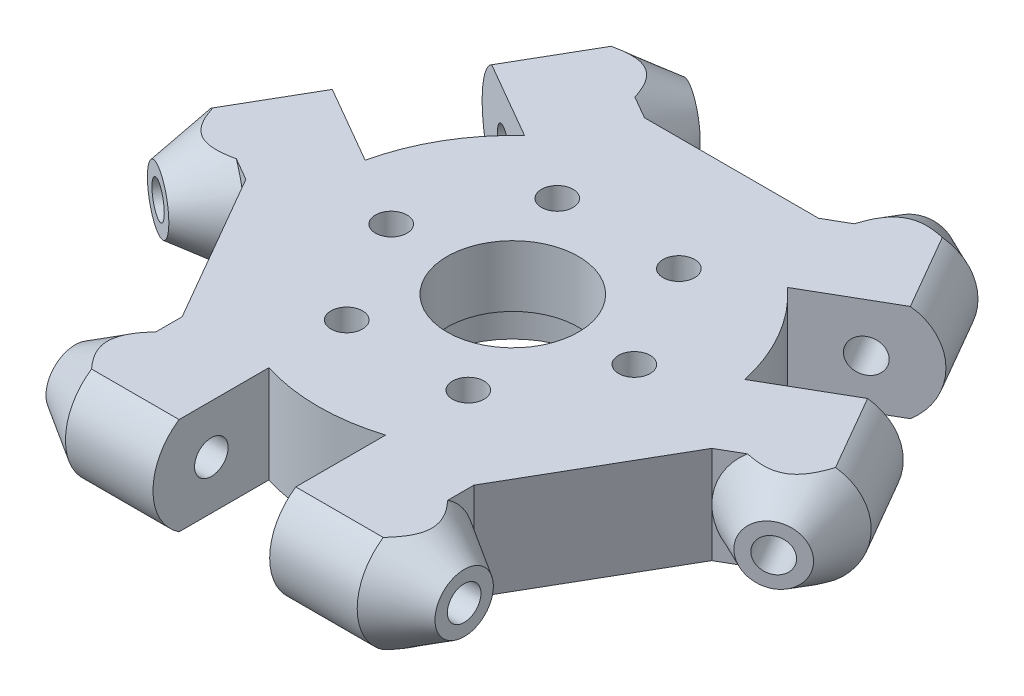
from build123d import *

# Parameters (mm, degrees)
BOSS_EXTRUDE1_DEPTH      = 5
BOSS_EXTRUDE1_DEPTH_BACK = 5
CIRPATTERN1_COUNT        = 3
SKETCH7_R                = 1.725
CUT_EXTRUDE2_DEPTH       = 47.868710659
CIRPATTERN2_COUNT        = 3
CUT_EXTRUDE3_DEPTH       = 47.751214304
CUT_EXTRUDE3_DEPTH_BACK  = 47.751214304
SKETCH8_R                = 8.5
SKETCH8_R_2              = 1.625
SKETCH9_R                = 8.5
SKETCH9_R_2              = 6.75
BOSS_EXTRUDE2_DEPTH      = 6.3


with BuildPart() as part:
    # Sketch4 → Boss-Extrude1 (new, two sides: drawn at the far end of the back side and taken through both)
    with BuildSketch(Plane(origin=(0, 0, 0), x_dir=(1, 0, 0), z_dir=(0, 1, 0)).offset(-BOSS_EXTRUDE1_DEPTH_BACK)):
        with BuildLine():
            Line((23.846787517, 20.696152423), (13.522711642, 14.735544437))
            ThreePointArc((13.522711642, 14.735544437), (17.320508076, 10), (19.522711642, 4.343239591))
            Line((19.522711642, 4.343239591), (29.846787517, 10.303847577))
            Line((29.846787517, 10.303847577), (34.346787517, 2.509618943))
            Line((34.346787517, 2.509618943), (23.954482672, -3.490381057))
            Line((23.954482672, -3.490381057), (15, -19))
            Line((15, -19), (15, -31))
            Line((15, -31), (6, -31))
            Line((6, -31), (6, -19.078784028))
            ThreePointArc((6, -19.078784028), (0, -20), (-6, -19.078784028))
            Line((-6, -19.078784028), (-6, -31))
            Line((-6, -31), (-15, -31))
            Line((-15, -31), (-15, -19))
            Line((-15, -19), (-23.954482672, -3.490381057))
            Line((-23.954482672, -3.490381057), (-34.346787517, 2.509618943))
            Line((-34.346787517, 2.509618943), (-29.846787517, 10.303847577))
            Line((-29.846787517, 10.303847577), (-19.522711642, 4.343239591))
            ThreePointArc((-19.522711642, 4.343239591), (-17.320508076, 10), (-13.522711642, 14.735544437))
            Line((-13.522711642, 14.735544437), (-23.846787517, 20.696152423))
            Line((-23.846787517, 20.696152423), (-19.346787517, 28.490381057))
            Line((-19.346787517, 28.490381057), (-8.954482672, 22.490381057))
            Line((-8.954482672, 22.490381057), (8.954482672, 22.490381057))
            Line((8.954482672, 22.490381057), (19.346787517, 28.490381057))
            Line((19.346787517, 28.490381057), (23.846787517, 20.696152423))
        make_face()
    extrude(amount=BOSS_EXTRUDE1_DEPTH + BOSS_EXTRUDE1_DEPTH_BACK)

    # Sketch6 → Revolve1 (revolve)
    with BuildSketch(Plane(origin=(0, 0, 0), x_dir=(1, 0, 0), z_dir=(0, 1, 0))):
        Polygon((-15, -25), (-20, -25), (-20, -28), (-15, -31), align=None)
        Polygon((15, -31), (15, -25), (20, -25), (20, -28), align=None)
    revolve1 = revolve(axis=Axis((-15, 0, 25), (1, 0, 0)))

    # CirPattern1: Revolve1 ×3 about axis
    cirpattern1_axis = Axis((0, 5, 0), (0, 1, 0))
    for i in range(1, CIRPATTERN1_COUNT):
        add(revolve1.rotate(cirpattern1_axis, i * 360 / CIRPATTERN1_COUNT))

    # Sketch7 → Cut-Extrude2 (cut, symmetric)
    with BuildSketch(Plane(origin=(0, 0, 0), x_dir=(0, 0, -1), z_dir=(1, 0, 0))):
        with Locations((-25, 0)):
            Circle(SKETCH7_R)
        with BuildLine():
            Line((-28.31662479, 5), (-19, 5))
            Line((-19, 5), (-19, 25))
            Line((-19, 25), (-39, 25))
            Line((-39, 25), (-39, -25))
            Line((-39, -25), (-19, -25))
            Line((-19, -25), (-19, -5))
            Line((-19, -5), (-28.31662479, -5))
            ThreePointArc((-28.31662479, -5), (-31, 0), (-28.31662479, 5))
        make_face()
    cut_extrude2 = extrude(amount=CUT_EXTRUDE2_DEPTH, both=True, mode=Mode.SUBTRACT)

    # CirPattern2: Cut-Extrude2 ×3 about axis
    cirpattern2_axis = Axis((0, 5, 0), (0, 1, 0))
    for i in range(1, CIRPATTERN2_COUNT):
        add(cut_extrude2.rotate(cirpattern2_axis, i * 360 / CIRPATTERN2_COUNT), mode=Mode.SUBTRACT)

    # Sketch8 → Cut-Extrude3 (cut, two sides: drawn at the far end of the back side and taken through both)
    with BuildSketch(Plane(origin=(0, 0, 0), x_dir=(1, 0, 0), z_dir=(0, 1, 0)).offset(-CUT_EXTRUDE3_DEPTH_BACK)):
        Circle(SKETCH8_R)
        with Locations((-12.5, 0)):
            Circle(SKETCH8_R_2)
        with Locations((-6.25, 10.825317547)):
            Circle(SKETCH8_R_2)
        with Locations((6.25, 10.825317547)):
            Circle(SKETCH8_R_2)
        with Locations((12.5, 0)):
            Circle(SKETCH8_R_2)
        with Locations((6.25, -10.825317547)):
            Circle(SKETCH8_R_2)
        with Locations((-6.25, -10.825317547)):
            Circle(SKETCH8_R_2)
    extrude(amount=CUT_EXTRUDE3_DEPTH + CUT_EXTRUDE3_DEPTH_BACK, mode=Mode.SUBTRACT)

    # Sketch9 → Boss-Extrude2 (add)
    with BuildSketch(Plane(origin=(0, 5, 0), x_dir=(1, 0, 0), z_dir=(0, 1, 0))):
        Circle(SKETCH9_R)
        Circle(SKETCH9_R_2, mode=Mode.SUBTRACT)
    extrude(amount=-BOSS_EXTRUDE2_DEPTH)


solid = part.part
